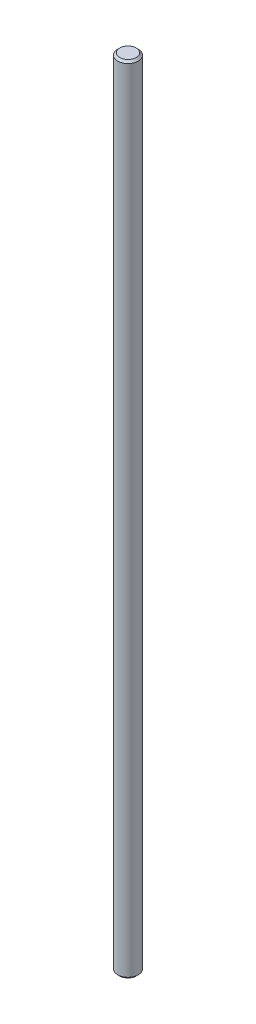
from build123d import *

# Parameters (mm, degrees)
SKETCH1_R           = 5
BOSS_EXTRUDE1_DEPTH = 192.5
CHAMFER1_SIZE       = 1


with BuildPart() as part:
    # Sketch1 → Boss-Extrude1 (new, symmetric)
    with BuildSketch(Plane(origin=(0, 0, 0), x_dir=(1, 0, 0), z_dir=(0, 1, 0))):
        with Locations(Location((0, 0, 0), (0, 0, 270))):
            Circle(SKETCH1_R)
    extrude(amount=BOSS_EXTRUDE1_DEPTH, both=True)

    # Chamfer1
    chamfer1_edges = [part.edges().sort_by_distance(p)[0] for p in [
        (0, -192.5, -5),
        (0, 192.5, -5),
    ]]
    chamfer(chamfer1_edges, length=CHAMFER1_SIZE)


solid = part.part
